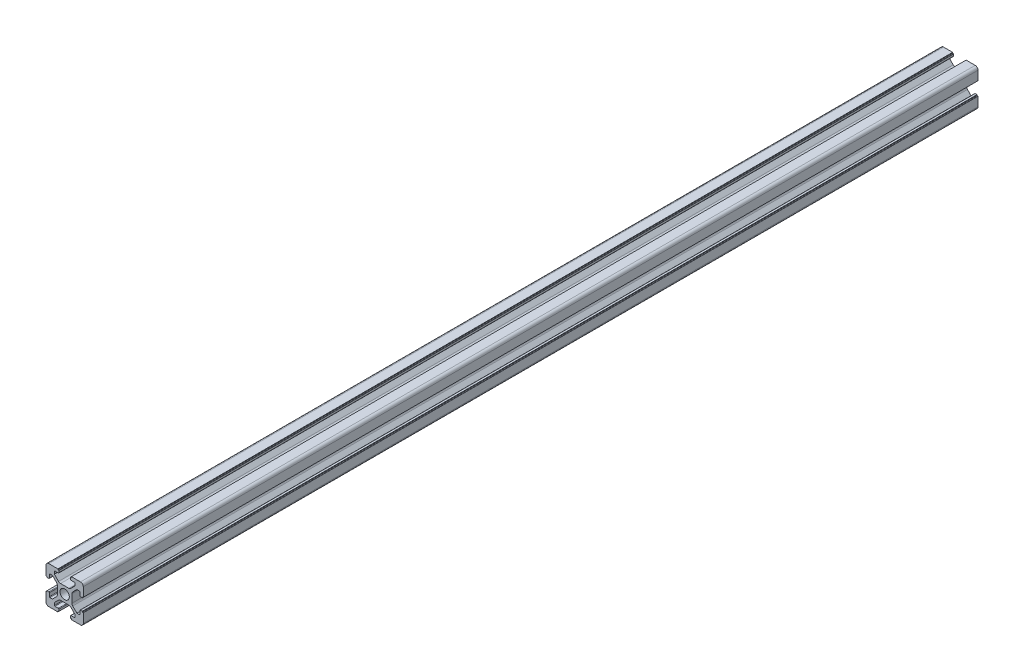
from build123d import *

# Parameters (mm, degrees)
SKETCH_1_R      = 2.5
EXTRUDE_1_DEPTH = 480


with BuildPart() as part:
    # 草图1 → 凸台-拉伸1 (new body)
    with BuildSketch(Plane.XY):
        with BuildLine():
            Line((4.215995631, 3.244230202), (6.436655803, 5.464890373))
            Line((6.436655803, 5.464890373), (7.776655803, 5.464890373))
            ThreePointArc((7.776655803, 5.464890373), (7.988787838, 5.377022408), (8.076655803, 5.164890373))
            Line((8.076655803, 5.164890373), (8.076655803, 3.364890373))
            ThreePointArc((8.076655803, 3.364890373), (8.164523769, 3.152758339), (8.376655803, 3.064890373))
            Line((8.376655803, 3.064890373), (9.376655803, 3.064890373))
            Line((9.376655803, 3.064890373), (9.376655803, 3.364890373))
            ThreePointArc((9.376655803, 3.364890373), (9.435234447, 3.50631173), (9.576655803, 3.564890373))
            Line((9.576655803, 3.564890373), (9.876655803, 3.564890373))
            Line((9.876655803, 3.564890373), (9.876655803, 8.464890373))
            ThreePointArc((9.876655803, 8.464890373), (9.437315975, 9.525550545), (8.376655803, 9.964890373))
            Line((8.376655803, 9.964890373), (3.476655803, 9.964890373))
            Line((3.476655803, 9.964890373), (3.476655803, 9.664890373))
            ThreePointArc((3.476655803, 9.664890373), (3.418077159, 9.523469017), (3.276655803, 9.464890373))
            Line((3.276655803, 9.464890373), (2.976655803, 9.464890373))
            Line((2.976655803, 9.464890373), (2.976655803, 8.464890373))
            ThreePointArc((2.976655803, 8.464890373), (3.064523769, 8.252758339), (3.276655803, 8.164890373))
            Line((3.276655803, 8.164890373), (5.076655803, 8.164890373))
            ThreePointArc((5.076655803, 8.164890373), (5.288787838, 8.077022408), (5.376655803, 7.864890373))
            Line((5.376655803, 7.864890373), (5.376655803, 6.524890373))
            Line((5.376655803, 6.524890373), (3.155995631, 4.304230202))
            ThreePointArc((3.155995631, 4.304230202), (2.669360608, 3.979071075), (2.09533546, 3.864890373))
            Line((2.09533546, 3.864890373), (-2.342023853, 3.864890373))
            ThreePointArc((-2.342023853, 3.864890373), (-2.916049002, 3.979071075), (-3.402684025, 4.304230202))
            Line((-3.402684025, 4.304230202), (-5.623344197, 6.524890373))
            Line((-5.623344197, 6.524890373), (-5.623344197, 7.864890373))
            ThreePointArc((-5.623344197, 7.864890373), (-5.535476231, 8.077022408), (-5.323344197, 8.164890373))
            Line((-5.323344197, 8.164890373), (-3.523344197, 8.164890373))
            ThreePointArc((-3.523344197, 8.164890373), (-3.311212162, 8.252758339), (-3.223344197, 8.464890373))
            Line((-3.223344197, 8.464890373), (-3.223344197, 9.464890373))
            Line((-3.223344197, 9.464890373), (-3.523344197, 9.464890373))
            ThreePointArc((-3.523344197, 9.464890373), (-3.664765553, 9.523469017), (-3.723344197, 9.664890373))
            Line((-3.723344197, 9.664890373), (-3.723344197, 9.964890373))
            Line((-3.723344197, 9.964890373), (-8.623344197, 9.964890373))
            ThreePointArc((-8.623344197, 9.964890373), (-9.684004369, 9.525550545), (-10.123344197, 8.464890373))
            Line((-10.123344197, 8.464890373), (-10.123344197, 3.564890373))
            Line((-10.123344197, 3.564890373), (-9.823344197, 3.564890373))
            ThreePointArc((-9.823344197, 3.564890373), (-9.681922841, 3.50631173), (-9.623344197, 3.364890373))
            Line((-9.623344197, 3.364890373), (-9.623344197, 3.064890373))
            Line((-9.623344197, 3.064890373), (-8.623344197, 3.064890373))
            ThreePointArc((-8.623344197, 3.064890373), (-8.411212162, 3.152758339), (-8.323344197, 3.364890373))
            Line((-8.323344197, 3.364890373), (-8.323344197, 5.164890373))
            ThreePointArc((-8.323344197, 5.164890373), (-8.235476231, 5.377022408), (-8.023344197, 5.464890373))
            Line((-8.023344197, 5.464890373), (-6.683344197, 5.464890373))
            Line((-6.683344197, 5.464890373), (-4.462684025, 3.244230202))
            ThreePointArc((-4.462684025, 3.244230202), (-4.137524898, 2.757595178), (-4.023344197, 2.18357003))
            Line((-4.023344197, 2.18357003), (-4.023344197, -2.253789283))
            ThreePointArc((-4.023344197, -2.253789283), (-4.137524898, -2.827814432), (-4.462684025, -3.314449455))
            Line((-4.462684025, -3.314449455), (-6.683344197, -5.535109627))
            Line((-6.683344197, -5.535109627), (-8.023344197, -5.535109627))
            ThreePointArc((-8.023344197, -5.535109627), (-8.235476231, -5.447241661), (-8.323344197, -5.235109627))
            Line((-8.323344197, -5.235109627), (-8.323344197, -3.435109627))
            ThreePointArc((-8.323344197, -3.435109627), (-8.411212162, -3.222977592), (-8.623344197, -3.135109627))
            Line((-8.623344197, -3.135109627), (-9.623344197, -3.135109627))
            Line((-9.623344197, -3.135109627), (-9.623344197, -3.435109627))
            ThreePointArc((-9.623344197, -3.435109627), (-9.681922841, -3.576530983), (-9.823344197, -3.635109627))
            Line((-9.823344197, -3.635109627), (-10.123344197, -3.635109627))
            Line((-10.123344197, -3.635109627), (-10.123344197, -8.535109627))
            ThreePointArc((-10.123344197, -8.535109627), (-9.684004369, -9.595769798), (-8.623344197, -10.035109627))
            Line((-8.623344197, -10.035109627), (-3.723344197, -10.035109627))
            Line((-3.723344197, -10.035109627), (-3.723344197, -9.735109627))
            ThreePointArc((-3.723344197, -9.735109627), (-3.664765553, -9.59368827), (-3.523344197, -9.535109627))
            Line((-3.523344197, -9.535109627), (-3.223344197, -9.535109627))
            Line((-3.223344197, -9.535109627), (-3.223344197, -8.535109627))
            ThreePointArc((-3.223344197, -8.535109627), (-3.311212162, -8.322977592), (-3.523344197, -8.235109627))
            Line((-3.523344197, -8.235109627), (-5.323344197, -8.235109627))
            ThreePointArc((-5.323344197, -8.235109627), (-5.535476231, -8.147241661), (-5.623344197, -7.935109627))
            Line((-5.623344197, -7.935109627), (-5.623344197, -6.595109627))
            Line((-5.623344197, -6.595109627), (-3.402684025, -4.374449455))
            ThreePointArc((-3.402684025, -4.374449455), (-2.916049002, -4.049290328), (-2.342023853, -3.935109627))
            Line((-2.342023853, -3.935109627), (2.09533546, -3.935109627))
            ThreePointArc((2.09533546, -3.935109627), (2.669360608, -4.049290328), (3.155995631, -4.374449455))
            Line((3.155995631, -4.374449455), (5.376655803, -6.595109627))
            Line((5.376655803, -6.595109627), (5.376655803, -7.935109627))
            ThreePointArc((5.376655803, -7.935109627), (5.288787838, -8.147241661), (5.076655803, -8.235109627))
            Line((5.076655803, -8.235109627), (3.276655803, -8.235109627))
            ThreePointArc((3.276655803, -8.235109627), (3.064523769, -8.322977592), (2.976655803, -8.535109627))
            Line((2.976655803, -8.535109627), (2.976655803, -9.535109627))
            Line((2.976655803, -9.535109627), (3.276655803, -9.535109627))
            ThreePointArc((3.276655803, -9.535109627), (3.418077159, -9.59368827), (3.476655803, -9.735109627))
            Line((3.476655803, -9.735109627), (3.476655803, -10.035109627))
            Line((3.476655803, -10.035109627), (8.376655803, -10.035109627))
            ThreePointArc((8.376655803, -10.035109627), (9.437315975, -9.595769798), (9.876655803, -8.535109627))
            Line((9.876655803, -8.535109627), (9.876655803, -3.635109627))
            Line((9.876655803, -3.635109627), (9.576655803, -3.635109627))
            ThreePointArc((9.576655803, -3.635109627), (9.435234447, -3.576530983), (9.376655803, -3.435109627))
            Line((9.376655803, -3.435109627), (9.376655803, -3.135109627))
            Line((9.376655803, -3.135109627), (8.376655803, -3.135109627))
            ThreePointArc((8.376655803, -3.135109627), (8.164523769, -3.222977592), (8.076655803, -3.435109627))
            Line((8.076655803, -3.435109627), (8.076655803, -5.235109627))
            ThreePointArc((8.076655803, -5.235109627), (7.988787838, -5.447241661), (7.776655803, -5.535109627))
            Line((7.776655803, -5.535109627), (6.436655803, -5.535109627))
            Line((6.436655803, -5.535109627), (4.215995631, -3.314449455))
            ThreePointArc((4.215995631, -3.314449455), (3.890836504, -2.827814432), (3.776655803, -2.253789283))
            Line((3.776655803, -2.253789283), (3.776655803, 2.18357003))
            ThreePointArc((3.776655803, 2.18357003), (3.890836504, 2.757595178), (4.215995631, 3.244230202))
        make_face()
        with Locations((-0.123344197, -0.035109627)):
            Circle(SKETCH_1_R, mode=Mode.SUBTRACT)
    extrude(amount=EXTRUDE_1_DEPTH)


solid = part.part
